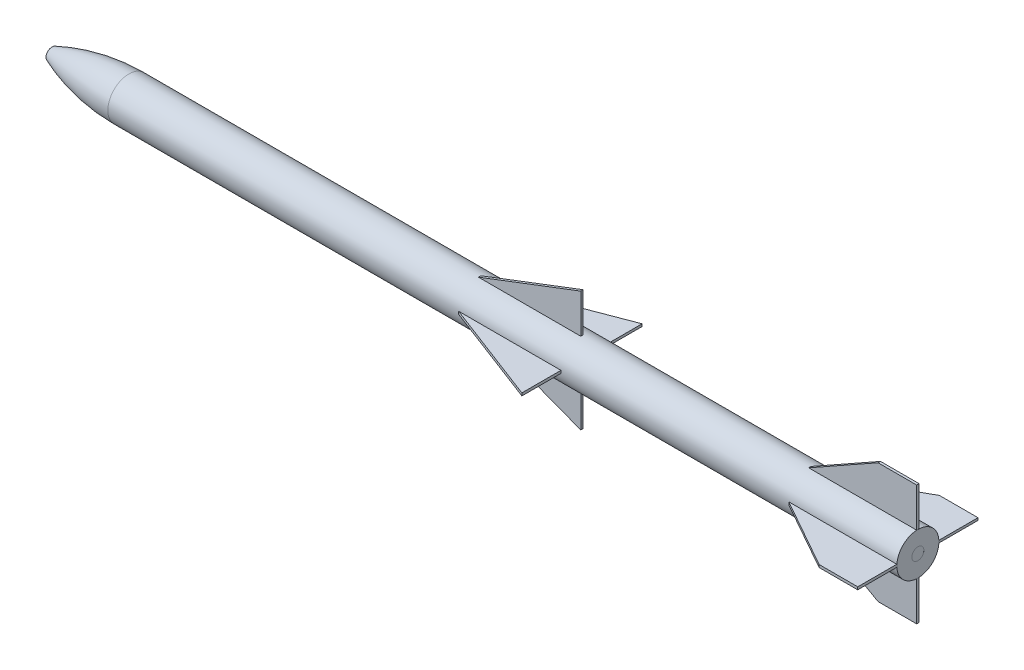
from build123d import *

# Parameters (mm, degrees)
BOSS_EXTRUDE2_DEPTH   = 50.8
BOSS_EXTRUDE2_2_DEPTH = 50.8
SKETCH8_W             = 165.09746
SKETCH8_H             = 20.403333325
SKETCH8_H_2           = 20.309182766
CUT_EXTRUDE1_DEPTH    = 762
SKETCH15_OUTSIDE_W    = 1249.4
SKETCH15_OUTSIDE_H    = 919.206
SKETCH15_OUTSIDE_W_2  = 165.09746
SKETCH15_OUTSIDE_H_2  = 11.138484042
CUT_EXTRUDE4_DEPTH    = 762
BOSS_EXTRUDE3_START   = 3657.6
SKETCH19_R            = 25.39746
BOSS_EXTRUDE3_DEPTH   = 3657.6
BOSS_EXTRUDE4_DEPTH   = 5.08
BOSS_EXTRUDE4_2_DEPTH = 5.08
BOSS_EXTRUDE5_DEPTH   = 5.08
BOSS_EXTRUDE5_2_DEPTH = 5.08
BOSS_EXTRUDE6_DEPTH   = 50.8
BOSS_EXTRUDE6_2_DEPTH = 50.8
SKETCH26_OUTSIDE_W    = 1255.5
SKETCH26_OUTSIDE_H    = 1255.5
SKETCH26_OUTSIDE_W_2  = 165.09746
SKETCH26_OUTSIDE_H_2  = 10.087483909
CUT_EXTRUDE7_DEPTH    = 508
SKETCH32_OUTSIDE_W    = 1255.5
SKETCH32_OUTSIDE_H    = 1255.5
SKETCH32_OUTSIDE_W_2  = 165.09746
SKETCH32_OUTSIDE_H_2  = 11.138484042
CUT_EXTRUDE16_DEPTH   = 508


with BuildPart() as part:
    # Sketch1 → Revolve-Thin10 (revolve)
    with BuildSketch(Plane.XY):
        with BuildLine():
            Line((-0.012988062, -0.00254), (3657.60254, -0.00254))
            Line((3657.60254, -0.00254), (3657.60254, 63.50254))
            Line((3657.60254, 63.50254), (324.708031431, 63.50254))
            ThreePointArc((324.708031431, 63.50254), (159.271762972, 47.477300947), (-0.012988062, -0.00254))
        make_face()
        with BuildLine():
            Line((0, 0), (3657.6, 0))
            Line((3657.6, 0), (3657.6, 63.5))
            Line((3657.6, 63.5), (324.708031431, 63.5))
            ThreePointArc((324.708031431, 63.5), (159.27862377, 47.476054557), (0, 0))
        make_face(mode=Mode.SUBTRACT)
    revolve(axis=Axis((3626.499601813, -25.4, 0), (-1, 0, 0)))

    # Sketch19 → Boss-Extrude3 (add)
    with BuildSketch(Plane(origin=(-0.012988062, 0, 0), x_dir=(0, 0, -1), z_dir=(1, 0, 0)).offset(BOSS_EXTRUDE3_START)):
        with Locations(Location((0, -25.4, 0), (0, 0, 90))):
            Circle(SKETCH19_R)
    extrude(amount=-BOSS_EXTRUDE3_DEPTH)


with BuildPart() as body_2:
    # Sketch4 → Boss-Extrude2 (new body)
    with BuildSketch(Plane(origin=(0, 0, 0), x_dir=(1, 0, 0), z_dir=(0, 1, 0))):
        Polygon((3201.438104891, 88.90254), (3657.60254, 88.90254), (3657.60254, 254), (3494.61986844, 254), align=None)
    extrude(amount=-BOSS_EXTRUDE2_DEPTH)

    # Sketch8 → Cut-Extrude1 (cut)
    with BuildSketch(Plane(origin=(3657.60254, 0, 0), x_dir=(0, 0, -1), z_dir=(1, 0, 0))):
        with Locations((171.45127, -10.201666663)):
            Rectangle(SKETCH8_W, SKETCH8_H)
        with Locations((171.45127, -40.645408617)):
            Rectangle(SKETCH8_W, SKETCH8_H_2)
    extrude(amount=-CUT_EXTRUDE1_DEPTH, mode=Mode.SUBTRACT)


with BuildPart() as body_3:
    # Sketch4 → Boss-Extrude2 2 (new body)
    with BuildSketch(Plane(origin=(0, 0, 0), x_dir=(1, 0, 0), z_dir=(0, 1, 0))):
        Polygon((3657.60254, -254), (3657.60254, -88.90254), (3201.438104891, -88.90254), (3494.61986844, -254), align=None)
    extrude(amount=-BOSS_EXTRUDE2_2_DEPTH)

    # Sketch15 outside → Cut-Extrude4 (cut)
    with BuildSketch(Plane(origin=(3657.60254, 0, 0), x_dir=(0, 0, -1), z_dir=(1, 0, 0))):
        with Locations((0, -25.4)):
            Rectangle(SKETCH15_OUTSIDE_W, SKETCH15_OUTSIDE_H)
        with Locations((-171.45127, -24.821822945)):
            Rectangle(SKETCH15_OUTSIDE_W_2, SKETCH15_OUTSIDE_H_2, mode=Mode.SUBTRACT)
    extrude(amount=-CUT_EXTRUDE4_DEPTH, mode=Mode.SUBTRACT)


with BuildPart() as body_4:
    # Sketch20 → Boss-Extrude4 (new, symmetric)
    with BuildSketch(Plane.XY):
        Polygon((3201.438104891, 63.50254), (3657.60254, 63.50254), (3657.60254, 228.6), (3494.61986844, 228.6), align=None)
    extrude(amount=BOSS_EXTRUDE4_DEPTH, both=True)


with BuildPart() as body_5:
    # Sketch20 → Boss-Extrude4 2 (new, symmetric)
    with BuildSketch(Plane.XY):
        Polygon((3657.60254, -279.4), (3657.60254, -114.30254), (3201.438104891, -114.30254), (3494.61986844, -279.4), align=None)
    extrude(amount=BOSS_EXTRUDE4_2_DEPTH, both=True)


with BuildPart() as body_6:
    # Sketch24 → Boss-Extrude5 (new, symmetric)
    with BuildSketch(Plane.XY):
        Polygon((2238.658103721, 228.6), (1806.360058945, 63.50254), (2238.658103721, 63.50254), align=None)
    extrude(amount=BOSS_EXTRUDE5_DEPTH, both=True)


with BuildPart() as body_7:
    # Sketch24 → Boss-Extrude5 2 (new, symmetric)
    with BuildSketch(Plane.XY):
        Polygon((2238.658103721, -114.30254), (1806.360058945, -114.30254), (2238.658103721, -279.4), align=None)
    extrude(amount=BOSS_EXTRUDE5_2_DEPTH, both=True)


with BuildPart() as body_8:
    # Sketch25 → Boss-Extrude6 (new body)
    with BuildSketch(Plane(origin=(0, 0, 0), x_dir=(1, 0, 0), z_dir=(0, 1, 0))):
        Polygon((1806.360058945, 88.90254), (2238.812613306, 88.90254), (2238.812613306, 254), align=None)
    extrude(amount=-BOSS_EXTRUDE6_DEPTH)

    # Sketch26 outside → Cut-Extrude7 (cut)
    with BuildSketch(Plane(origin=(2238.812613306, 0, 0), x_dir=(0, 0, -1), z_dir=(1, 0, 0))):
        with Locations((0, -25.4)):
            Rectangle(SKETCH26_OUTSIDE_W, SKETCH26_OUTSIDE_H)
        with Locations((171.45127, -25.44707528)):
            Rectangle(SKETCH26_OUTSIDE_W_2, SKETCH26_OUTSIDE_H_2, mode=Mode.SUBTRACT)
    extrude(amount=-CUT_EXTRUDE7_DEPTH, mode=Mode.SUBTRACT)


with BuildPart() as body_9:
    # Sketch25 → Boss-Extrude6 2 (new body)
    with BuildSketch(Plane(origin=(0, 0, 0), x_dir=(1, 0, 0), z_dir=(0, 1, 0))):
        Polygon((2238.812613306, -254), (2238.812613306, -88.90254), (1806.360058945, -88.90254), align=None)
    extrude(amount=-BOSS_EXTRUDE6_2_DEPTH)

    # Sketch32 outside → Cut-Extrude16 (cut)
    with BuildSketch(Plane(origin=(2238.812613306, 0, 0), x_dir=(0, 0, -1), z_dir=(1, 0, 0))):
        with Locations((0, -25.4)):
            Rectangle(SKETCH32_OUTSIDE_W, SKETCH32_OUTSIDE_H)
        with Locations((-171.45127, -24.821822945)):
            Rectangle(SKETCH32_OUTSIDE_W_2, SKETCH32_OUTSIDE_H_2, mode=Mode.SUBTRACT)
    extrude(amount=-CUT_EXTRUDE16_DEPTH, mode=Mode.SUBTRACT)


solid = Compound([part.part, body_2.part, body_3.part, body_4.part, body_5.part, body_6.part, body_7.part, body_8.part, body_9.part])
